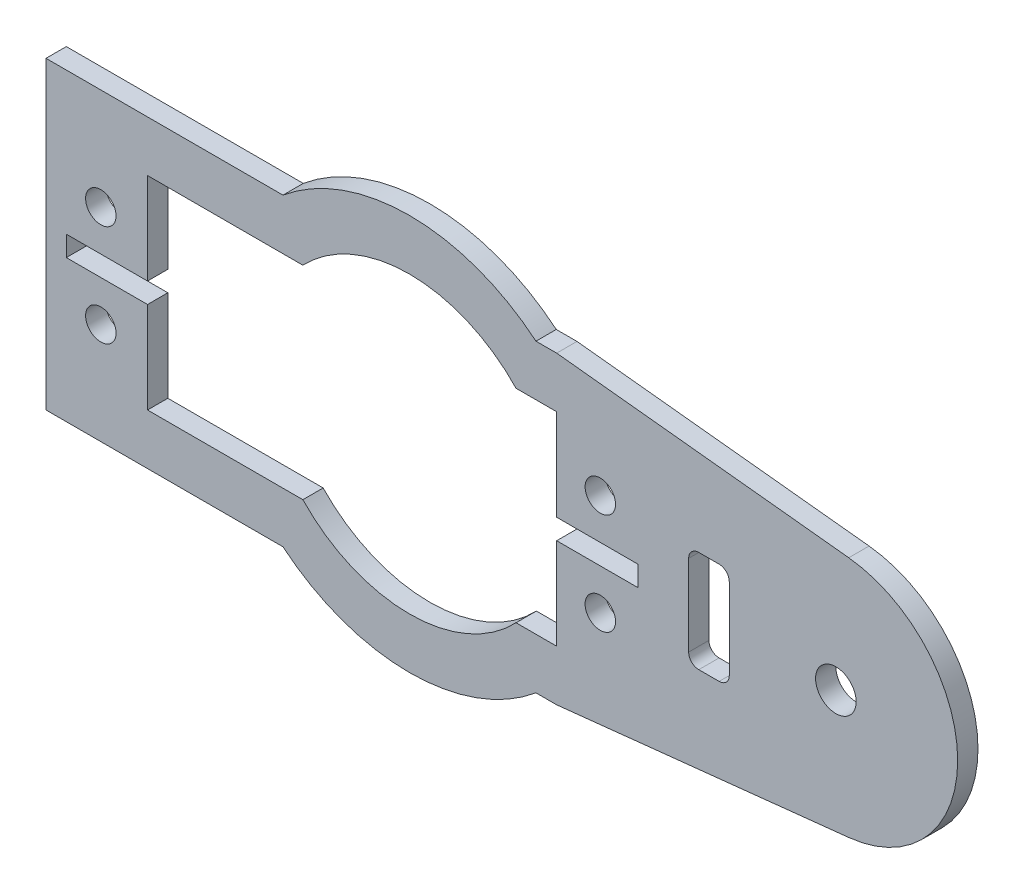
from build123d import *

# Parameters (mm, degrees)
SKETCH1_R      = 2
EXTRUDE1_DEPTH = 2
SKETCH2_R      = 1.5
EXTRUDE2_DEPTH = 2
EXTRUDE3_DEPTH = 2
EXTRUDE4_DEPTH = 2
SKETCH5_R      = 14.5
EXTRUDE5_DEPTH = 2


with BuildPart() as part:
    # Sketch1 → Extrude1 (new body)
    with BuildSketch(Plane.XY):
        with BuildLine():
            Line((1.27220287, -11.932371929), (-27.5, -15))
            Line((-27.5, -15), (-29.540064206, -15))
            ThreePointArc((-29.540064206, -15), (-42, -19.5), (-54.459935794, -15))
            Line((-54.459935794, -15), (-77.8, -15))
            Line((-77.8, -15), (-77.8, 15))
            Line((-77.8, 15), (-54.459935794, 15))
            ThreePointArc((-54.459935794, 15), (-42, 19.5), (-29.540064206, 15))
            Line((-29.540064206, 15), (-27.5, 15))
            Line((-27.5, 15), (1.27220287, 11.932371929))
            ThreePointArc((1.27220287, 11.932371929), (12, 0), (1.27220287, -11.932371929))
        make_face()
        Circle(SKETCH1_R, mode=Mode.SUBTRACT)
    extrude(amount=EXTRUDE1_DEPTH)

    # Sketch2 → Extrude2 (cut)
    with BuildSketch(Plane.XY.offset(2)):
        with Locations((-23.2, 5)):
            Circle(SKETCH2_R)
        with Locations((-72.4, 5)):
            Circle(SKETCH2_R)
        with Locations(Location((-23.2, -5, 0), (0, 0, 180))):
            Circle(SKETCH2_R)
        with Locations(Location((-72.4, -5, 0), (0, 0, 180))):
            Circle(SKETCH2_R)
    extrude(amount=-EXTRUDE2_DEPTH, mode=Mode.SUBTRACT)

    # Sketch3 → Extrude3 (cut)
    with BuildSketch(Plane.XY.offset(2)):
        with BuildLine():
            Line((-13.5, 5), (-11.5, 5))
            ThreePointArc((-11.5, 5), (-10.792893219, 4.707106781), (-10.5, 4))
            Line((-10.5, 4), (-10.5, -4))
            ThreePointArc((-10.5, -4), (-10.792893219, -4.707106781), (-11.5, -5))
            Line((-11.5, -5), (-13.5, -5))
            ThreePointArc((-13.5, -5), (-14.207106781, -4.707106781), (-14.5, -4))
            Line((-14.5, -4), (-14.5, 4))
            ThreePointArc((-14.5, 4), (-14.207106781, 4.707106781), (-13.5, 5))
        make_face()
    extrude(amount=-EXTRUDE3_DEPTH, mode=Mode.SUBTRACT)

    # Sketch4 → Extrude4 (cut)
    with BuildSketch(Plane.XY.offset(2)):
        Polygon((-27.5, -1), (-27.5, -10), (-67.8, -10), (-67.8, -1), (-75.8, -1), (-75.8, 1), (-67.8, 1), (-67.8, 10), (-27.5, 10), (-27.5, 1), (-19.5, 1), (-19.5, -1), align=None)
    extrude(amount=-EXTRUDE4_DEPTH, mode=Mode.SUBTRACT)

    # Sketch5 → Extrude5 (cut)
    with BuildSketch(Plane.XY.offset(2)):
        with Locations((-42, 0)):
            Circle(SKETCH5_R)
    extrude(amount=-EXTRUDE5_DEPTH, mode=Mode.SUBTRACT)


solid = part.part
